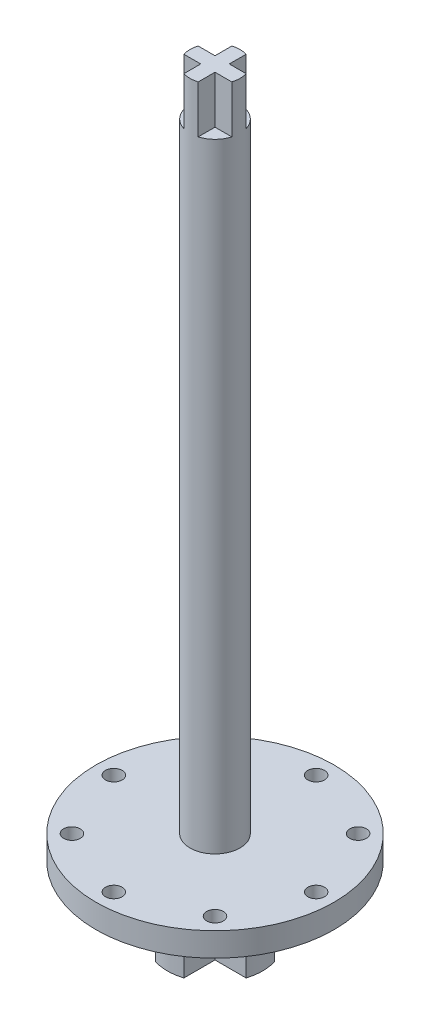
from build123d import *

# Parameters (mm, degrees)
SKETCH2_R          = 1.75
CUT_EXTRUDE1_DEPTH = 10
CUT_EXTRUDE2_DEPTH = 15
CUT_EXTRUDE3_START = -10
CUT_EXTRUDE3_DEPTH = 10


with BuildPart() as part:
    # Sketch1 → Revolve1 (revolve)
    with BuildSketch(Plane(origin=(0, 0, 0), x_dir=(0, 0, -1), z_dir=(1, 0, 0))):
        Polygon((-5.25, 80), (-5.25, -60), (-25, -60), (-25, -65), (-10, -65), (-10, -80), (0, -80), (0, 80), align=None)
    revolve(axis=Axis((0, 49.914529915, 0), (0, -1, 0)))

    # Sketch2 → Cut-Extrude1 (cut)
    with BuildSketch(Plane(origin=(0, -60, 0), x_dir=(1, 0, 0), z_dir=(0, 1, 0))):
        with Locations(Location((0, -21.25, 0), (0, 0, 270))):
            Circle(SKETCH2_R)
        with Locations(Location((-15.0260191, -15.0260191, 0), (0, 0, 270))):
            Circle(SKETCH2_R)
        with Locations(Location((-21.25, 0, 0), (0, 0, 270))):
            Circle(SKETCH2_R)
        with Locations(Location((-15.0260191, 15.0260191, 0), (0, 0, 270))):
            Circle(SKETCH2_R)
        with Locations(Location((0, 21.25, 0), (0, 0, 270))):
            Circle(SKETCH2_R)
        with Locations(Location((15.0260191, 15.0260191, 0), (0, 0, 270))):
            Circle(SKETCH2_R)
        with Locations(Location((21.25, 0, 0), (0, 0, 270))):
            Circle(SKETCH2_R)
        with Locations(Location((15.0260191, -15.0260191, 0), (0, 0, 270))):
            Circle(SKETCH2_R)
    extrude(amount=-CUT_EXTRUDE1_DEPTH, mode=Mode.SUBTRACT)

    # Sketch3 → Cut-Extrude2 (cut)
    with BuildSketch(Plane.XZ.offset(80)):
        with BuildLine():
            Line((-3, 9.539392014), (-3, 3))
            Line((-3, 3), (-9.539392014, 3))
            ThreePointArc((-9.539392014, 3), (-7.071067812, 7.071067812), (-3, 9.539392014))
        make_face()
        with BuildLine():
            Line((-3, -3), (-9.539392014, -3))
            ThreePointArc((-9.539392014, -3), (-7.071067812, -7.071067812), (-3, -9.539392014))
            Line((-3, -9.539392014), (-3, -3))
        make_face()
        with BuildLine():
            Line((3, -3), (9.539392014, -3))
            ThreePointArc((9.539392014, -3), (7.071067812, -7.071067812), (3, -9.539392014))
            Line((3, -9.539392014), (3, -3))
        make_face()
        with BuildLine():
            Line((3, 3), (9.539392014, 3))
            ThreePointArc((9.539392014, 3), (7.071067812, 7.071067812), (3, 9.539392014))
            Line((3, 9.539392014), (3, 3))
        make_face()
    extrude(amount=-CUT_EXTRUDE2_DEPTH, mode=Mode.SUBTRACT)

    # Sketch4 → Cut-Extrude3 (cut)
    with BuildSketch(Plane(origin=(0, 80, 0), x_dir=(1, 0, 0), z_dir=(0, 1, 0)).offset(CUT_EXTRUDE3_START)):
        with BuildLine():
            Line((-1.5, -1.5), (-5.031152949, -1.5))
            ThreePointArc((-5.031152949, -1.5), (-3.712310601, -3.712310601), (-1.5, -5.031152949))
            Line((-1.5, -5.031152949), (-1.5, -1.5))
        make_face()
        with BuildLine():
            Line((1.5, -1.5), (1.5, -5.031152949))
            ThreePointArc((1.5, -5.031152949), (3.712310601, -3.712310601), (5.031152949, -1.5))
            Line((5.031152949, -1.5), (1.5, -1.5))
        make_face()
        with BuildLine():
            ThreePointArc((5.031152949, 1.5), (3.712310601, 3.712310601), (1.5, 5.031152949))
            Line((1.5, 5.031152949), (1.5, 1.5))
            Line((1.5, 1.5), (5.031152949, 1.5))
        make_face()
        with BuildLine():
            ThreePointArc((-5.031152949, 1.5), (-3.712310601, 3.712310601), (-1.5, 5.031152949))
            Line((-1.5, 5.031152949), (-1.5, 1.5))
            Line((-1.5, 1.5), (-5.031152949, 1.5))
        make_face()
    extrude(amount=CUT_EXTRUDE3_DEPTH, mode=Mode.SUBTRACT)


solid = part.part
